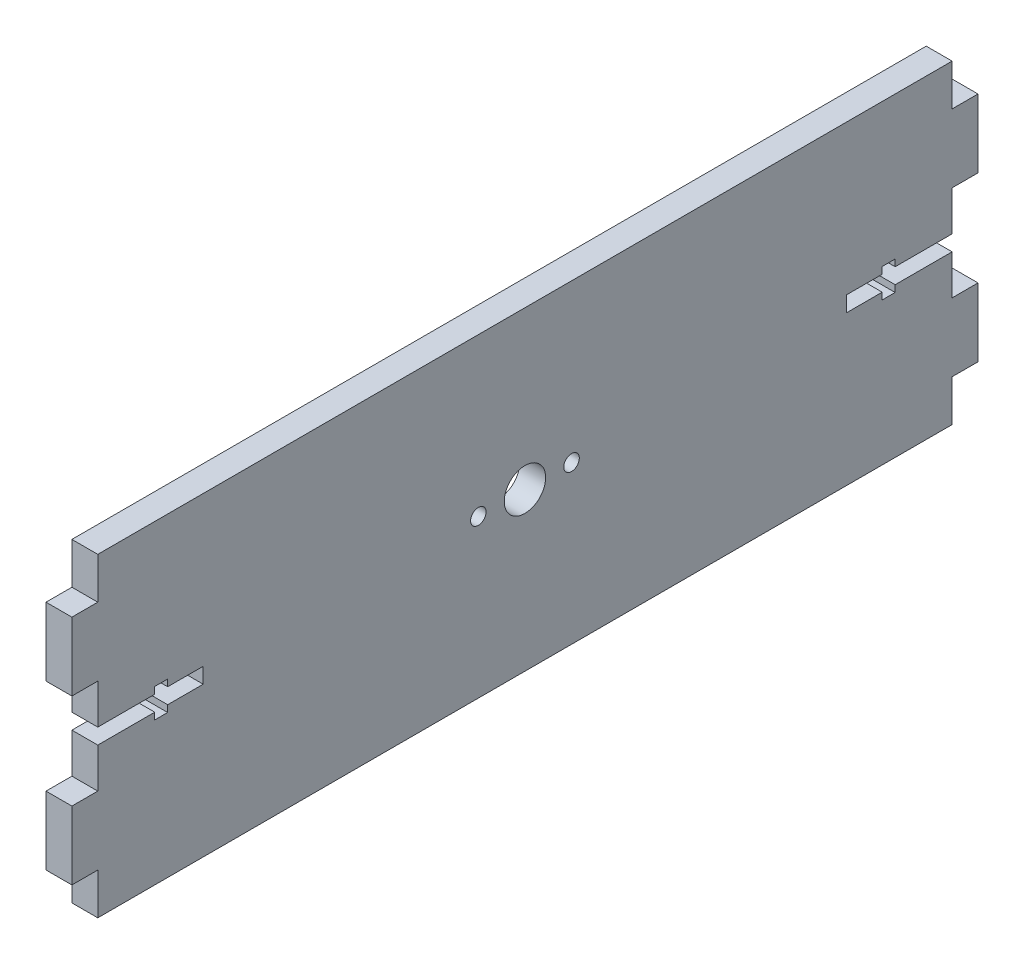
from build123d import *

# Parameters (mm, degrees)
SKETCH1_R           = 4
SKETCH1_R_2         = 1.5
BOSS_EXTRUDE1_DEPTH = 5


with BuildPart() as part:
    # Sketch1 → Boss-Extrude1 (new body)
    with BuildSketch(Plane(origin=(0, 0, 0), x_dir=(0, 0, -1), z_dir=(1, 0, 0))):
        Polygon((70.251703358, 12.402398233), (70.251703358, 25.602398233), (65.251703358, 25.602398233), (65.251703358, 33.602398233), (-99.748296642, 33.602398233), (-99.748296642, 25.602398233), (-104.748296642, 25.602398233), (-104.748296642, 12.402398233), (-99.748296642, 12.402398233), (-99.748296642, 4.702398233), (-88.748296642, 4.702398233), (-88.748296642, 6.002398233), (-86.248296642, 6.002398233), (-86.248296642, 4.702398233), (-79.39106139, 4.702398233), (-79.39106139, 1.702398233), (-86.248296642, 1.702398233), (-86.248296642, 0.402398233), (-88.748296642, 0.402398233), (-88.748296642, 1.702398233), (-99.748296642, 1.702398233), (-99.748296642, -5.997601767), (-104.748296642, -5.997601767), (-104.748296642, -19.197601767), (-99.748296642, -19.197601767), (-99.748296642, -27.197601767), (65.251703358, -27.197601767), (65.251703358, -19.197601767), (70.251703358, -19.197601767), (70.251703358, -5.997601767), (65.251703358, -5.997601767), (65.251703358, 1.702398233), (54.251703358, 1.702398233), (54.251703358, 0.402398233), (51.751703358, 0.402398233), (51.751703358, 1.702398233), (44.894468105, 1.702398233), (44.894468105, 4.702398233), (51.751703358, 4.702398233), (51.751703358, 6.002398233), (54.251703358, 6.002398233), (54.251703358, 4.702398233), (65.251703358, 4.702398233), (65.251703358, 12.402398233), align=None)
        with Locations((-17.248296642, 3.202398233)):
            Circle(SKETCH1_R, mode=Mode.SUBTRACT)
        with Locations((-26.248296642, 3.202398233)):
            Circle(SKETCH1_R_2, mode=Mode.SUBTRACT)
        with Locations((-8.248296642, 3.202398233)):
            Circle(SKETCH1_R_2, mode=Mode.SUBTRACT)
    extrude(amount=BOSS_EXTRUDE1_DEPTH)


solid = part.part
